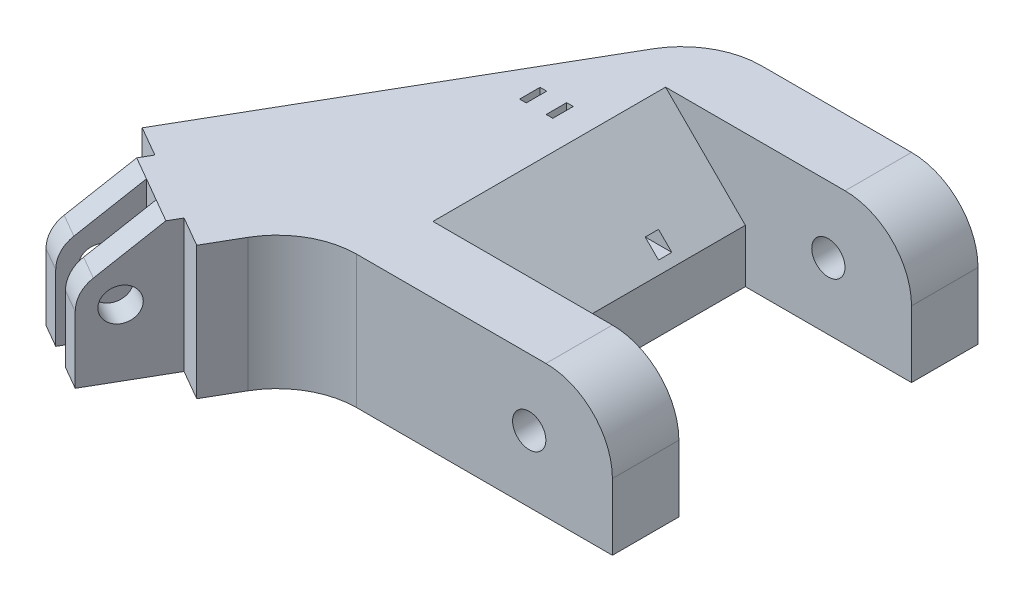
from build123d import *

# Parameters (mm, degrees)
BOSS_EXTRUDE1_DEPTH     = 25.4
CUT_EXTRUDE1_DEPTH      = 110.310025801
CUT_EXTRUDE1_DEPTH_BACK = 110.310025801
SKETCH8_R               = 3.175
SKETCH9_R               = 3.175
CUT_EXTRUDE2_DEPTH      = 25.4
CUT_EXTRUDE3_DEPTH      = 75.639044044
CUT_EXTRUDE4_DEPTH      = 25.4
SKETCH14_W              = 33.446436581
SKETCH14_H              = 25.4
BOSS_EXTRUDE2_DEPTH     = 6.604
SKETCH15_W              = 83.98171134
SKETCH15_H              = 25.4
BOSS_EXTRUDE3_DEPTH     = 6.604
CUT_EXTRUDE5_DEPTH      = 79.566235631
FILLET11_R              = 12.7
CHAMFER1_SIZE           = 15.24
FILLET12_R              = 15.24
CUT_EXTRUDE6_DEPTH      = 1.27
CUT_EXTRUDE6_DEPTH_BACK = 1.27
CUT_EXTRUDE7_DEPTH      = 77.311629432
CUT_EXTRUDE7_DEPTH_BACK = 77.311629432
SKETCH21_W              = 1.27
SKETCH21_H              = 3.908978547


with BuildPart() as part:
    # Sketch2 → Boss-Extrude1 (new body)
    with BuildSketch(Plane(origin=(0, 0, 0), x_dir=(1, 0, 0), z_dir=(0, 1, 0))):
        Polygon((-0.93668344, 51.22431719), (-50.540816327, -34.692561236), (-46.141407275, -37.232561236), (-39.798130059, -26.24568281), (-35.398721007, -28.78568281), (-41.741998224, -39.772561236), (-37.342589173, -42.312561236), (-30.999311956, -31.32568281), (41.60831656, -31.32568281), (41.60831656, -5.92568281), (9.85831656, -5.92568281), (9.85831656, 38.52431719), (41.60831656, 38.52431719), (41.60831656, 51.22431719), align=None)
    extrude(amount=BOSS_EXTRUDE1_DEPTH)

    # Sketch8 → Cut-Extrude1 (cut, two sides: drawn at the far end of the back side and taken through both)
    with BuildSketch(Plane(origin=(0, 0, -51.22431719), x_dir=(-1, 0, 0), z_dir=(0, 0, -1)).offset(-CUT_EXTRUDE1_DEPTH_BACK)):
        with Locations((-25.7175, 12.7)):
            Circle(SKETCH8_R)
    extrude(amount=CUT_EXTRUDE1_DEPTH + CUT_EXTRUDE1_DEPTH_BACK, mode=Mode.SUBTRACT)

    # Sketch9 → Cut-Extrude2 (cut)
    with BuildSketch(Plane(origin=(-9.685065415, 0, -5.591675124), x_dir=(0.5000000000000036, 0, -0.8660254037844367), z_dir=(0.8660254037844366, 0, 0.5000000000000034))):
        with Locations((-48.965047516, 12.7)):
            Circle(SKETCH9_R)
    extrude(amount=-CUT_EXTRUDE2_DEPTH, mode=Mode.SUBTRACT)

    # Sketch11 → Cut-Extrude3 (cut, through all)
    with BuildSketch(Plane(origin=(-9.685065415, 0, -5.591675124), x_dir=(0.5000000000000036, 0, -0.8660254037844367), z_dir=(0.8660254037844366, 0, 0.5000000000000034))):
        with BuildLine():
            Line((-42.628493082, 25.4), (-52.778275903, 17.777577106))
            ThreePointArc((-52.778275903, 17.777577106), (-54.645562469, 15.538001034), (-55.315047516, 12.7))
            Line((-55.315047516, 12.7), (-55.315047516, 25.4))
            Line((-55.315047516, 25.4), (-42.628493082, 25.4))
        make_face()
    extrude(amount=-CUT_EXTRUDE3_DEPTH, mode=Mode.SUBTRACT)

    # Sketch12 → Cut-Extrude4 (cut)
    with BuildSketch(Plane(origin=(0, 25.4, 0), x_dir=(1, 0, 0), z_dir=(0, 1, 0))):
        Polygon((41.60831656, -18.62568281), (-23.666963538, -18.62568281), (-30.999311956, -31.32568281), (41.60831656, -31.32568281), align=None)
    extrude(amount=-CUT_EXTRUDE4_DEPTH, mode=Mode.SUBTRACT)

    # Sketch14 → Boss-Extrude2 (add)
    with BuildSketch(Plane(origin=(-9.685065415, 0, -5.591675124), x_dir=(0.5000000000000036, 0, -0.8660254037844367), z_dir=(0.8660254037844366, 0, 0.5000000000000034))):
        with Locations((-23.365274791, 12.7)):
            Rectangle(SKETCH14_W, SKETCH14_H)
    extrude(amount=BOSS_EXTRUDE2_DEPTH)

    # Sketch15 → Boss-Extrude3 (add)
    with BuildSketch(Plane(origin=(-22.883292569, 0, -13.211675124), x_dir=(-0.5000000000000002, 0, 0.8660254037844386), z_dir=(-0.8660254037844385, 0, -0.5000000000000001))):
        with Locations((-1.902362588, 12.7)):
            Rectangle(SKETCH15_W, SKETCH15_H)
    extrude(amount=BOSS_EXTRUDE3_DEPTH)

    # Sketch16 → Cut-Extrude5 (cut, through all)
    with BuildSketch(Plane(origin=(0, 25.4, 0), x_dir=(1, 0, 0), z_dir=(0, 1, 0))):
        Polygon((-0.93668344, 51.22431719), (-8.562325795, 51.22431719), (-6.655915206, 54.52631719), align=None)
    extrude(amount=-CUT_EXTRUDE5_DEPTH, mode=Mode.SUBTRACT)

    # Fillet11
    fillet11_edges = [part.edges().sort_by_distance(p)[0] for p in [
        (41.60831656, 25.4, -44.87431719),
        (41.60831656, 25.4, 12.27568281),
    ]]
    fillet(fillet11_edges, radius=FILLET11_R)

    # Chamfer1
    chamfer1_edges = [part.edges().sort_by_distance(p)[0] for p in [
        (9.85831656, 25.4, -16.29931719),
    ]]
    chamfer(chamfer1_edges, length=CHAMFER1_SIZE)

    # Fillet12
    fillet12_edges = [part.edges().sort_by_distance(p)[0] for p in [
        (-16.041321182, 12.7, 18.62568281),
        (-8.562325795, 12.7, -51.22431719),
    ]]
    fillet(fillet12_edges, radius=FILLET12_R)

    # Sketch19 → Cut-Extrude6 (cut, two sides: drawn at the far end of the back side and taken through both)
    with BuildSketch(Plane(origin=(0, 12.7, 0), x_dir=(1, 0, 0), z_dir=(0, 1, 0)).offset(-CUT_EXTRUDE6_DEPTH_BACK)):
        Polygon((-39.798130059, -26.24568281), (-35.398721007, -28.78568281), (-5.38168344, 23.20535135), (9.85831656, 23.20535135), (9.85831656, 25.74535135), (-5.38168344, 25.74535135), (-17.281047632, 25.74535135), (-17.281047632, 23.20535135), (-7.063084393, 23.20535135), align=None)
    extrude(amount=CUT_EXTRUDE6_DEPTH + CUT_EXTRUDE6_DEPTH_BACK, mode=Mode.SUBTRACT)

    # Sketch21 → Cut-Extrude7 (cut, two sides: drawn at the far end of the back side and taken through both)
    with BuildSketch(Plane(origin=(0, 25.4, 0), x_dir=(1, 0, 0), z_dir=(0, 1, 0)).offset(-CUT_EXTRUDE7_DEPTH_BACK)):
        with Locations((-16.708566929, 24.548624707)):
            Rectangle(SKETCH21_W, SKETCH21_H)
        with Locations((-11.628566929, 24.548624707)):
            Rectangle(SKETCH21_W, SKETCH21_H)
    extrude(amount=CUT_EXTRUDE7_DEPTH + CUT_EXTRUDE7_DEPTH_BACK, mode=Mode.SUBTRACT)


solid = part.part
